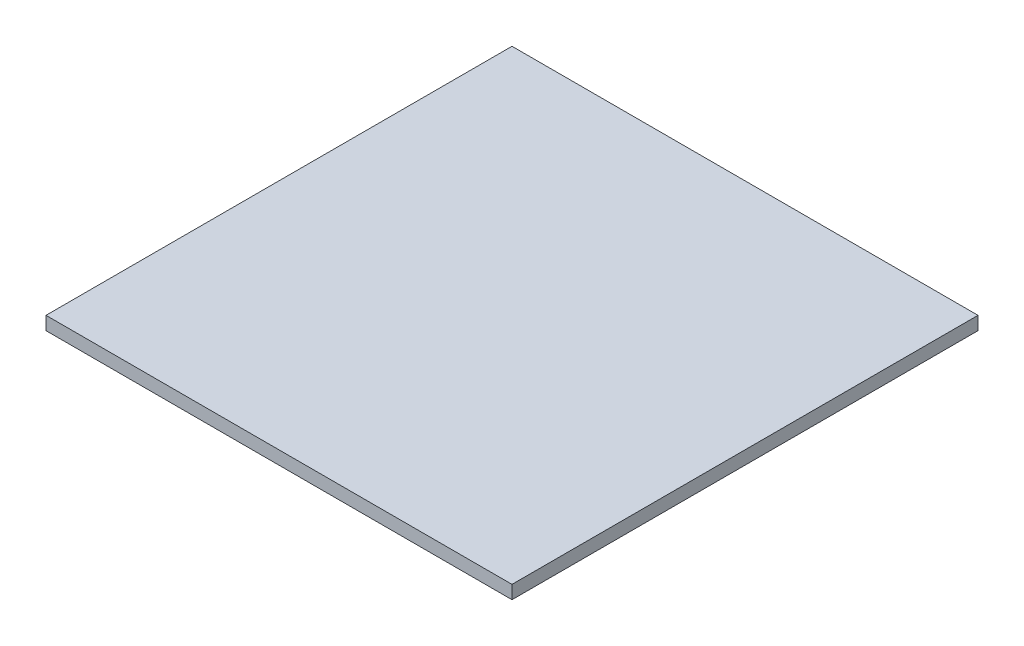
from build123d import *

# Parameters (mm, degrees)
SZKIC1_W                    = 280
SZKIC1_H                    = 280
DODANIE_WYCI_GNI_CIE1_DEPTH = 8


with BuildPart() as part:
    # Szkic1 → Dodanie-wyciągnięcie1 (new body)
    with BuildSketch(Plane(origin=(0, 0, 0), x_dir=(1, 0, 0), z_dir=(0, 1, 0))):
        with Locations((-3.006134969, 86.963190184)):
            Rectangle(SZKIC1_W, SZKIC1_H)
    extrude(amount=DODANIE_WYCI_GNI_CIE1_DEPTH)


solid = part.part
